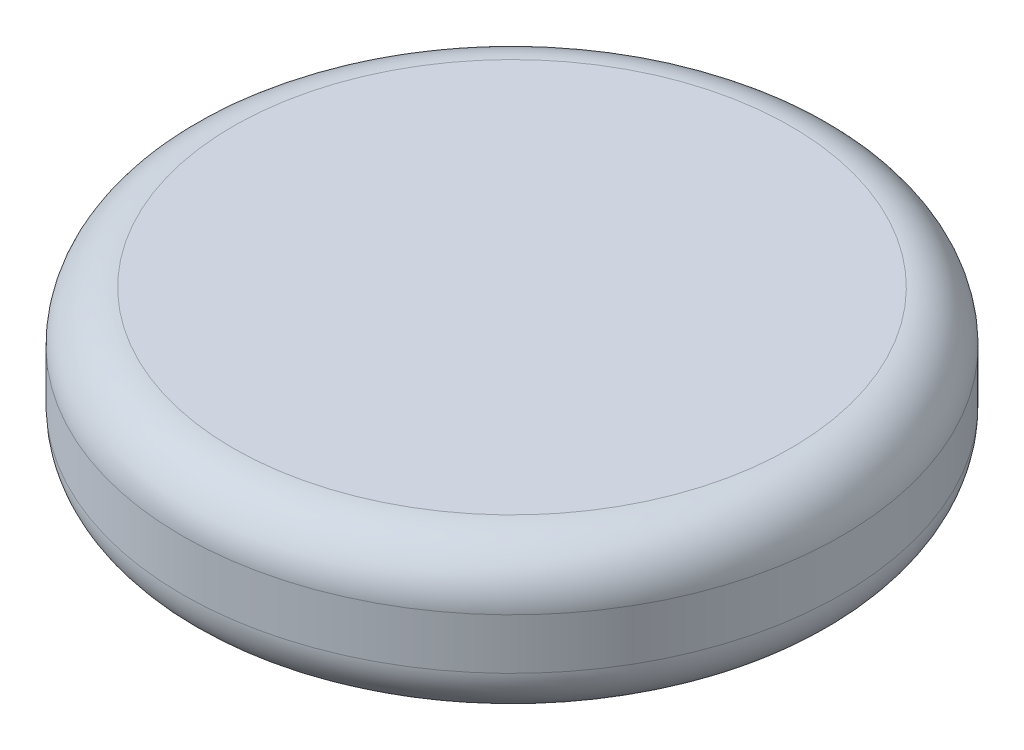
from build123d import *

# Parameters (mm, degrees)
SKETCH1_R           = 41.275
BOSS_EXTRUDE1_DEPTH = 19.05
FILLET1_R           = 6.35


with BuildPart() as part:
    # Sketch1 → Boss-Extrude1 (new body)
    with BuildSketch(Plane(origin=(0, 0, 0), x_dir=(1, 0, 0), z_dir=(0, 1, 0))):
        with Locations(Location((0, 0, 0), (0, 0, 90))):
            Circle(SKETCH1_R)
    extrude(amount=BOSS_EXTRUDE1_DEPTH)

    # Fillet1
    fillet1_edges = [part.edges().sort_by_distance(p)[0] for p in [
        (0, 0, 41.275),
        (0, 19.05, 41.275),
    ]]
    fillet(fillet1_edges, radius=FILLET1_R)


solid = part.part
